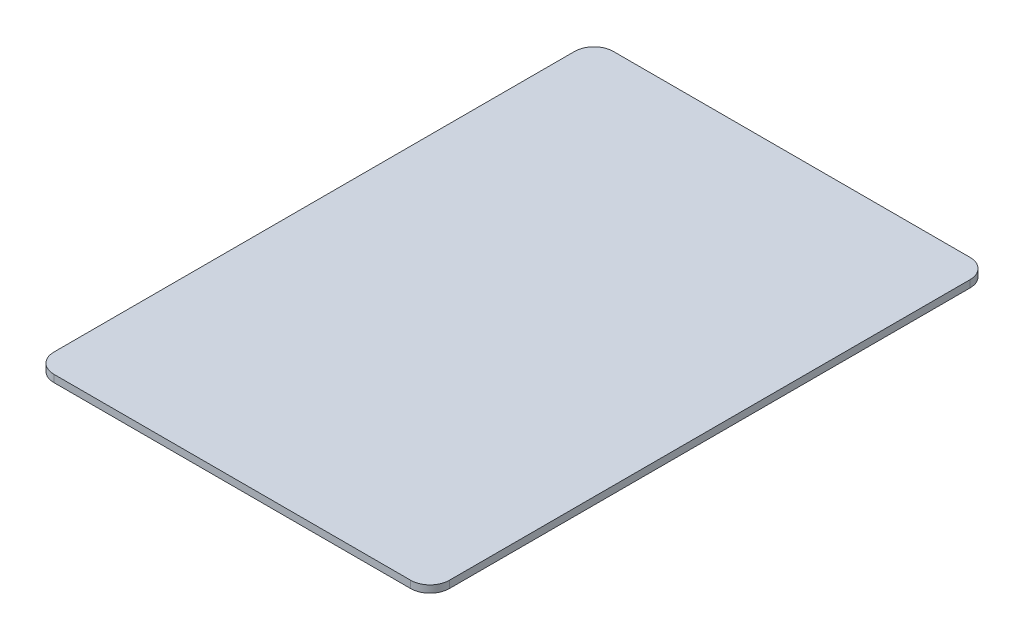
from build123d import *

# Parameters (mm, degrees)
SKETCH1_W           = 104.14
SKETCH1_H           = 147.32
BOSS_EXTRUDE1_DEPTH = 1.905
FILLET1_R           = 5.08


with BuildPart() as part:
    # Sketch1 → Boss-Extrude1 (new body)
    with BuildSketch(Plane(origin=(0, 0, 0), x_dir=(1, 0, 0), z_dir=(0, 1, 0))):
        Rectangle(SKETCH1_W, SKETCH1_H)
    extrude(amount=BOSS_EXTRUDE1_DEPTH)

    # Fillet1
    fillet1_edges = [part.edges().sort_by_distance(p)[0] for p in [
        (-52.07, 0.9525, 73.66),
        (52.07, 0.9525, 73.66),
        (52.07, 0.9525, -73.66),
        (-52.07, 0.9525, -73.66),
    ]]
    fillet(fillet1_edges, radius=FILLET1_R)


solid = part.part
